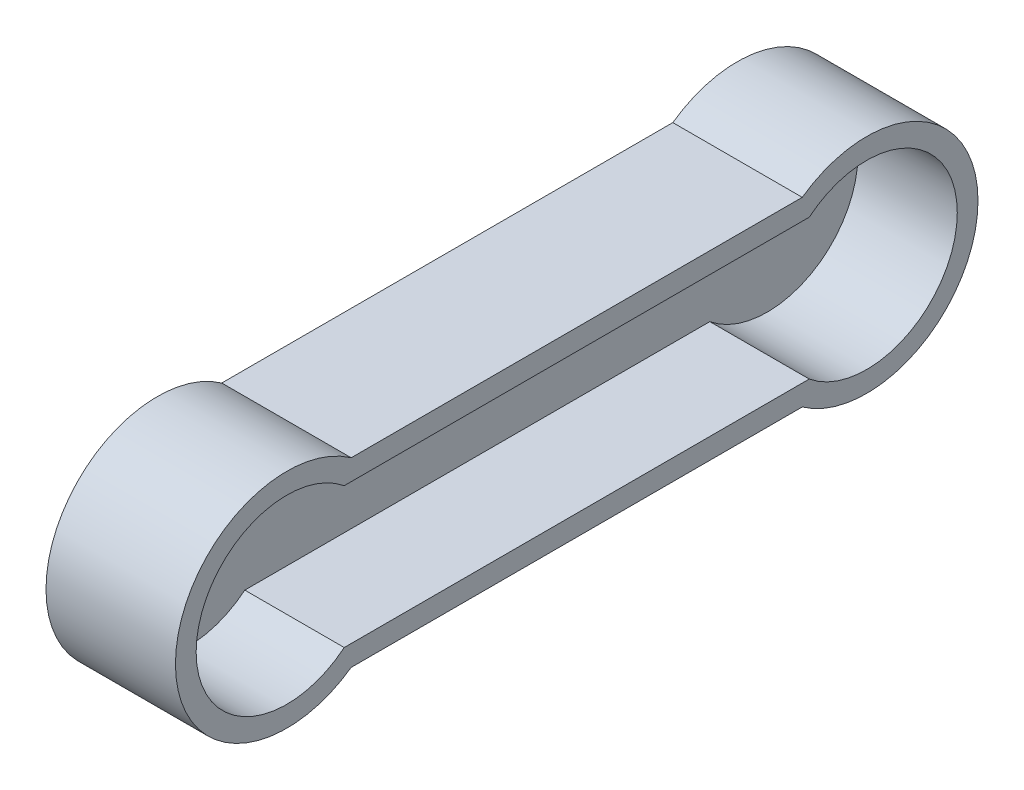
from build123d import *

# Parameters (mm, degrees)
CROQUIS1_R              = 5
SALIENTE_EXTRUIR1_DEPTH = 12.5
CORTAR_EXTRUIR1_START   = -19.2
CROQUIS2_R              = 5
CORTAR_EXTRUIR1_DEPTH   = 19.2


with BuildPart() as part:
    # Croquis1 → Saliente-Extruir1 (new, symmetric)
    # profile 1 of 5: a face of its own
    with BuildSketch(Plane(origin=(0, 0, 0), x_dir=(0, 0, -1), z_dir=(1, 0, 0))):
        with BuildLine():
            Line((-46.862494928, -17.533403612), (-46.862494928, 17.533403612))
            Line((-46.862494928, 17.533403612), (-40.251383817, 17.533403612))
            ThreePointArc((-40.251383817, 17.533403612), (-74.194444444, 0), (-40.251383817, -17.533403612))
            Line((-40.251383817, -17.533403612), (-46.862494928, -17.533403612))
        make_face()
        with Locations((-52.694444444, 0)):
            Circle(CROQUIS1_R, mode=Mode.SUBTRACT)
    # profile 2 of 5: a face of its own
    with BuildSketch(Plane(origin=(0, 0, 0), x_dir=(0, 0, -1), z_dir=(1, 0, 0))):
        with BuildLine():
            Line((-40.251383817, 17.533403612), (-46.862494928, 17.533403612))
            Line((-46.862494928, 17.533403612), (-46.862494928, -17.533403612))
            Line((-46.862494928, -17.533403612), (-40.251383817, -17.533403612))
            ThreePointArc((-40.251383817, -17.533403612), (-33.592405241, -9.867223432), (-31.194444444, 0))
            ThreePointArc((-31.194444444, 0), (-33.592405241, 9.867223432), (-40.251383817, 17.533403612))
        make_face()
    # profile 3 of 5: a face of its own
    with BuildSketch(Plane(origin=(0, 0, 0), x_dir=(0, 0, -1), z_dir=(1, 0, 0))):
        with BuildLine():
            Line((46.862494928, 17.533403612), (-40.251383817, 17.533403612))
            ThreePointArc((-40.251383817, 17.533403612), (-33.592405241, 9.867223432), (-31.194444444, 0))
            ThreePointArc((-31.194444444, 0), (-33.592405241, -9.867223432), (-40.251383817, -17.533403612))
            Line((-40.251383817, -17.533403612), (46.862494928, -17.533403612))
            ThreePointArc((46.862494928, -17.533403612), (37.805555556, 0), (46.862494928, 17.533403612))
        make_face()
    # profile 4 of 5: a face of its own
    with BuildSketch(Plane(origin=(0, 0, 0), x_dir=(0, 0, -1), z_dir=(1, 0, 0))):
        with BuildLine():
            Line((46.862494928, -17.533403612), (46.862494928, 17.533403612))
            ThreePointArc((46.862494928, 17.533403612), (37.805555556, 0), (46.862494928, -17.533403612))
        make_face()
    # profile 5 of 5: a face of its own
    with BuildSketch(Plane(origin=(0, 0, 0), x_dir=(0, 0, -1), z_dir=(1, 0, 0))):
        with BuildLine():
            ThreePointArc((80.805555556, 0), (69.172778987, 19.102039204), (46.862494928, 17.533403612))
            Line((46.862494928, 17.533403612), (46.862494928, -17.533403612))
            ThreePointArc((46.862494928, -17.533403612), (69.172778987, -19.102039204), (80.805555556, 0))
        make_face()
        with Locations((59.305555556, 0)):
            Circle(CROQUIS1_R, mode=Mode.SUBTRACT)
    extrude(amount=SALIENTE_EXTRUIR1_DEPTH, both=True)

    # Croquis2 → Cortar-Extruir1 (cut)
    # profile 1 of 7: a face of its own
    with BuildSketch(Plane(origin=(12.5, 0, 0), x_dir=(0, 0, -1), z_dir=(1, 0, 0)).offset(CORTAR_EXTRUIR1_START)):
        with BuildLine():
            Line((-61.940275078, -13.533403612), (-61.940275078, 13.533403612))
            Line((-61.940275078, 13.533403612), (-41.599536302, 13.533403612))
            ThreePointArc((-41.599536302, 13.533403612), (-70.194444444, 0), (-41.599536302, -13.533403612))
            Line((-41.599536302, -13.533403612), (-61.940275078, -13.533403612))
        make_face()
    # profile 2 of 7: a face of its own
    with BuildSketch(Plane(origin=(12.5, 0, 0), x_dir=(0, 0, -1), z_dir=(1, 0, 0)).offset(CORTAR_EXTRUIR1_START)):
        with BuildLine():
            Line((-41.599536302, 13.533403612), (-61.940275078, 13.533403612))
            Line((-61.940275078, 13.533403612), (-61.940275078, -13.533403612))
            Line((-61.940275078, -13.533403612), (-41.599536302, -13.533403612))
            ThreePointArc((-41.599536302, -13.533403612), (-36.876560697, -7.486291055), (-35.194444444, 0))
            ThreePointArc((-35.194444444, 0), (-36.876560697, 7.486291055), (-41.599536302, 13.533403612))
        make_face()
        with Locations((-52.694444444, 0)):
            Circle(CROQUIS2_R, mode=Mode.SUBTRACT)
    # profile 3 of 7: a face of its own
    with BuildSketch(Plane(origin=(12.5, 0, 0), x_dir=(0, 0, -1), z_dir=(1, 0, 0)).offset(CORTAR_EXTRUIR1_START)):
        with BuildLine():
            Line((48.210647414, 13.533403612), (-41.599536302, 13.533403612))
            ThreePointArc((-41.599536302, 13.533403612), (-36.876560697, 7.486291055), (-35.194444444, 0))
            ThreePointArc((-35.194444444, 0), (-36.876560697, -7.486291055), (-41.599536302, -13.533403612))
            Line((-41.599536302, -13.533403612), (48.210647414, -13.533403612))
            ThreePointArc((48.210647414, -13.533403612), (41.805555556, 0), (48.210647414, 13.533403612))
        make_face()
    # profile 4 of 7: a face of its own
    with BuildSketch(Plane(origin=(12.5, 0, 0), x_dir=(0, 0, -1), z_dir=(1, 0, 0)).offset(CORTAR_EXTRUIR1_START)):
        with BuildLine():
            ThreePointArc((76.805555556, 0), (66.79184661, 15.817883747), (48.210647414, 13.533403612))
            Line((48.210647414, 13.533403612), (61.940275078, 13.533403612))
            Line((61.940275078, 13.533403612), (61.940275078, 4.249500328))
            ThreePointArc((61.940275078, 4.249500328), (63.67439966, 2.431707465), (64.305555556, 0))
            ThreePointArc((64.305555556, 0), (63.67439966, -2.431707465), (61.940275078, -4.249500328))
            Line((61.940275078, -4.249500328), (61.940275078, -13.533403612))
            Line((61.940275078, -13.533403612), (48.210647414, -13.533403612))
            ThreePointArc((48.210647414, -13.533403612), (66.79184661, -15.817883747), (76.805555556, 0))
        make_face()
    # profile 5 of 7: a face of its own
    with BuildSketch(Plane(origin=(12.5, 0, 0), x_dir=(0, 0, -1), z_dir=(1, 0, 0)).offset(CORTAR_EXTRUIR1_START)):
        with BuildLine():
            Line((61.940275078, 13.533403612), (48.210647414, 13.533403612))
            ThreePointArc((48.210647414, 13.533403612), (41.805555556, 0), (48.210647414, -13.533403612))
            Line((48.210647414, -13.533403612), (61.940275078, -13.533403612))
            Line((61.940275078, -13.533403612), (61.940275078, -4.249500328))
            ThreePointArc((61.940275078, -4.249500328), (54.305555556, 0), (61.940275078, 4.249500328))
            Line((61.940275078, 4.249500328), (61.940275078, 13.533403612))
        make_face()
    # profile 6 of 7: a face of its own
    with BuildSketch(Plane(origin=(12.5, 0, 0), x_dir=(0, 0, -1), z_dir=(1, 0, 0)).offset(CORTAR_EXTRUIR1_START)):
        with BuildLine():
            ThreePointArc((76.805555556, 0), (66.79184661, 15.817883747), (48.210647414, 13.533403612))
            Line((48.210647414, 13.533403612), (61.940275078, 13.533403612))
            Line((61.940275078, 13.533403612), (61.940275078, 4.249500328))
            ThreePointArc((61.940275078, 4.249500328), (63.67439966, 2.431707465), (64.305555556, 0))
            ThreePointArc((64.305555556, 0), (63.67439966, -2.431707465), (61.940275078, -4.249500328))
            Line((61.940275078, -4.249500328), (61.940275078, -13.533403612))
            Line((61.940275078, -13.533403612), (48.210647414, -13.533403612))
            ThreePointArc((48.210647414, -13.533403612), (66.79184661, -15.817883747), (76.805555556, 0))
        make_face()
    # profile 7 of 7: a face of its own
    with BuildSketch(Plane(origin=(12.5, 0, 0), x_dir=(0, 0, -1), z_dir=(1, 0, 0)).offset(CORTAR_EXTRUIR1_START)):
        with BuildLine():
            Line((61.940275078, 13.533403612), (48.210647414, 13.533403612))
            ThreePointArc((48.210647414, 13.533403612), (41.805555556, 0), (48.210647414, -13.533403612))
            Line((48.210647414, -13.533403612), (61.940275078, -13.533403612))
            Line((61.940275078, -13.533403612), (61.940275078, -4.249500328))
            ThreePointArc((61.940275078, -4.249500328), (54.305555556, 0), (61.940275078, 4.249500328))
            Line((61.940275078, 4.249500328), (61.940275078, 13.533403612))
        make_face()
    extrude(amount=CORTAR_EXTRUIR1_DEPTH, mode=Mode.SUBTRACT)


solid = part.part
